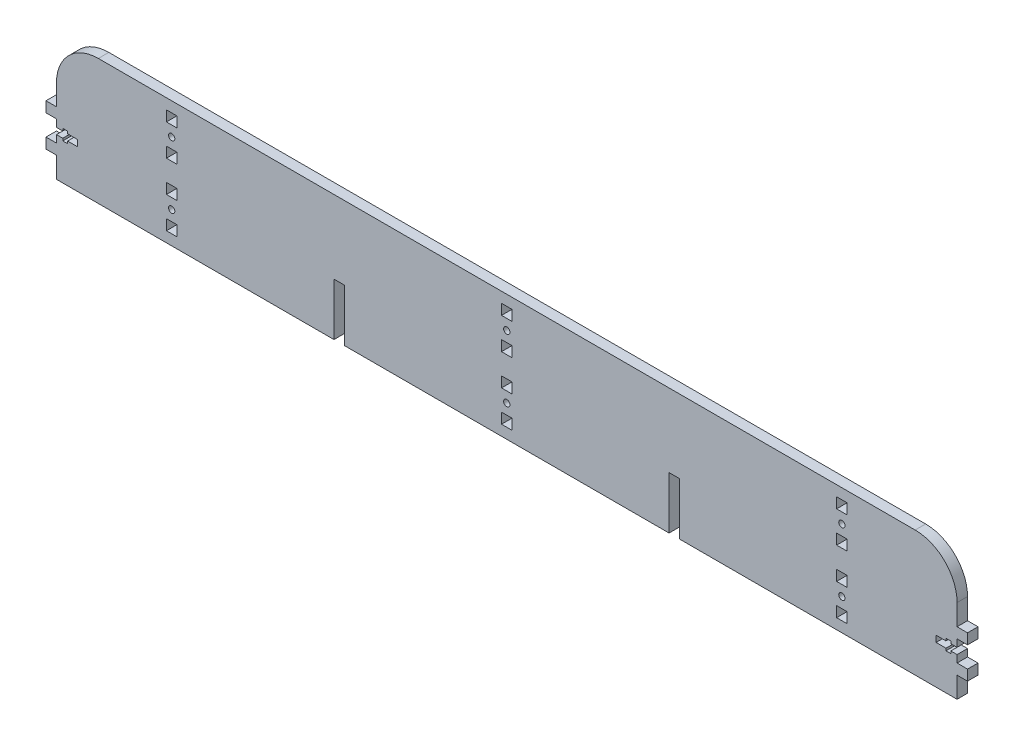
from build123d import *

# Parameters (mm, degrees)
ESQUISSE1_R        = 1.5
ESQUISSE1_W        = 5
ESQUISSE1_H        = 5
BOSS_EXTRU_1_DEPTH = 5
CONG_1_R           = 20


with BuildPart() as part:
    # Esquisse1 → Boss.-Extru.1 (new body)
    with BuildSketch(Plane.XY):
        Polygon((0, 21.5), (0, 25), (-5, 25), (-5, 30), (0, 30), (0, 60), (430, 60), (430, 30), (435, 30), (435, 25), (430, 25), (430, 21.5), (427, 21.5), (427, 22.6), (424.7, 22.6), (424.7, 21.5), (420, 21.5), (420, 18.5), (424.7, 18.5), (424.7, 17.4), (427, 17.4), (427, 18.5), (430, 18.5), (430, 15), (435, 15), (435, 10), (430, 10), (430, 0), (297.5, 0), (297.5, 25), (292.5, 25), (292.5, 0), (137.5, 0), (137.5, 25), (132.5, 25), (132.5, 0), (0, 0), (0, 10), (-5, 10), (-5, 15), (0, 15), (0, 18.5), (3, 18.5), (3, 17.4), (5.3, 17.4), (5.3, 18.5), (10, 18.5), (10, 21.5), (5.3, 21.5), (5.3, 22.6), (3, 22.6), (3, 21.5), align=None)
        with Locations((375, 15)):
            Circle(ESQUISSE1_R, mode=Mode.SUBTRACT)
        with Locations((375, 45)):
            Circle(ESQUISSE1_R, mode=Mode.SUBTRACT)
        with Locations((215, 15)):
            Circle(ESQUISSE1_R, mode=Mode.SUBTRACT)
        with Locations((215, 45)):
            Circle(ESQUISSE1_R, mode=Mode.SUBTRACT)
        with Locations((55, 15)):
            Circle(ESQUISSE1_R, mode=Mode.SUBTRACT)
        with Locations((55, 45)):
            Circle(ESQUISSE1_R, mode=Mode.SUBTRACT)
        with Locations((375, 7.5)):
            Rectangle(ESQUISSE1_W, ESQUISSE1_H, mode=Mode.SUBTRACT)
        with Locations((375, 22.5)):
            Rectangle(ESQUISSE1_W, ESQUISSE1_H, mode=Mode.SUBTRACT)
        with Locations((375, 37.5)):
            Rectangle(ESQUISSE1_W, ESQUISSE1_H, mode=Mode.SUBTRACT)
        with Locations((375, 52.5)):
            Rectangle(ESQUISSE1_W, ESQUISSE1_H, mode=Mode.SUBTRACT)
        with Locations((215, 7.5)):
            Rectangle(ESQUISSE1_W, ESQUISSE1_H, mode=Mode.SUBTRACT)
        with Locations((215, 22.5)):
            Rectangle(ESQUISSE1_W, ESQUISSE1_H, mode=Mode.SUBTRACT)
        with Locations((215, 37.5)):
            Rectangle(ESQUISSE1_W, ESQUISSE1_H, mode=Mode.SUBTRACT)
        with Locations((215, 52.5)):
            Rectangle(ESQUISSE1_W, ESQUISSE1_H, mode=Mode.SUBTRACT)
        with Locations((55, 7.5)):
            Rectangle(ESQUISSE1_W, ESQUISSE1_H, mode=Mode.SUBTRACT)
        with Locations((55, 22.5)):
            Rectangle(ESQUISSE1_W, ESQUISSE1_H, mode=Mode.SUBTRACT)
        with Locations((55, 37.5)):
            Rectangle(ESQUISSE1_W, ESQUISSE1_H, mode=Mode.SUBTRACT)
        with Locations((55, 52.5)):
            Rectangle(ESQUISSE1_W, ESQUISSE1_H, mode=Mode.SUBTRACT)
    extrude(amount=BOSS_EXTRU_1_DEPTH)

    # Congé1
    cong_1_edges = [part.edges().sort_by_distance(p)[0] for p in [
        (0, 60, 2.5),
        (430, 60, 2.5),
    ]]
    fillet(cong_1_edges, radius=CONG_1_R)


solid = part.part
